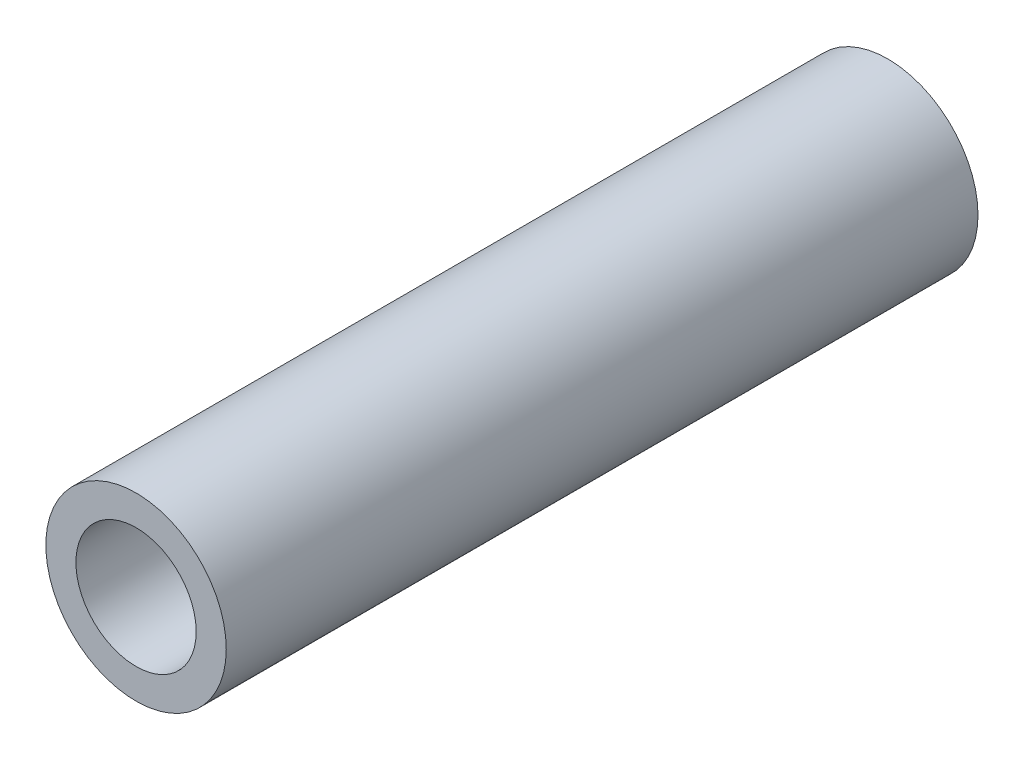
from build123d import *

# Parameters (mm, degrees)
SKETCH_1_R      = 3
SKETCH_1_R_2    = 2
EXTRUDE_1_DEPTH = 25


with BuildPart() as part:
    # ｽｹｯﾁ1 → ﾎﾞｽ - 押し出し1 (new body)
    with BuildSketch(Plane.XY):
        Circle(SKETCH_1_R)
        Circle(SKETCH_1_R_2, mode=Mode.SUBTRACT)
    extrude(amount=EXTRUDE_1_DEPTH)


solid = part.part
